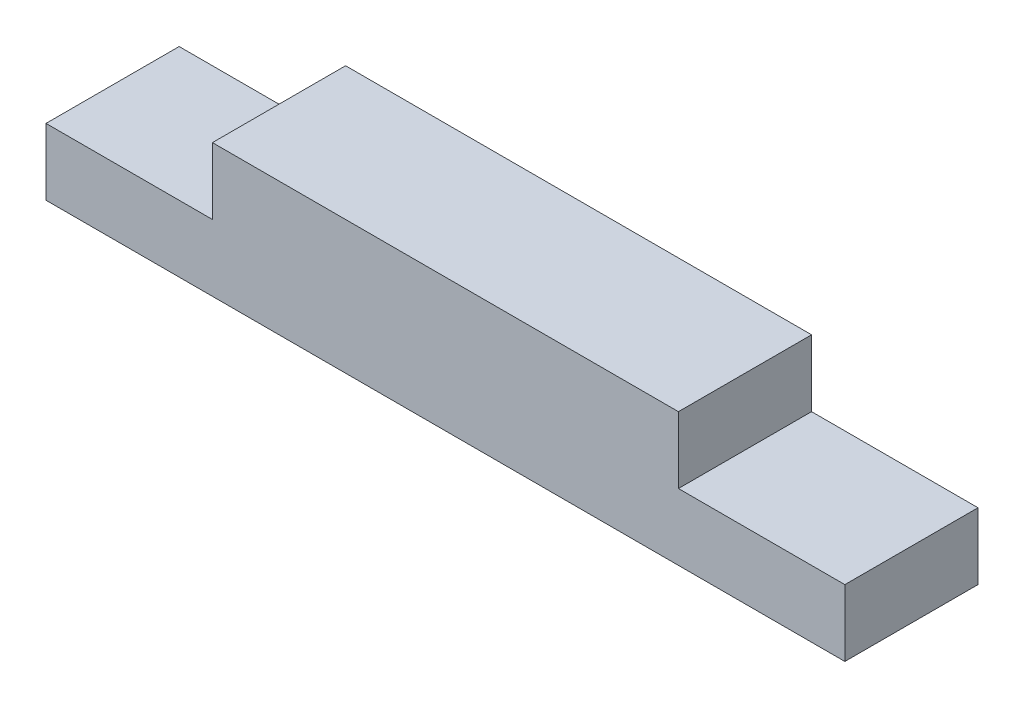
from build123d import *

# Parameters (mm, degrees)
SKETCH1_W           = 120
SKETCH1_H           = 20
BOSS_EXTRUDE1_DEPTH = 20
SKETCH2_W           = 25
SKETCH2_H           = 10
CUT_EXTRUDE1_DEPTH  = 20
SKETCH5_R           = 4.25
CUT_EXTRUDE3_DEPTH  = 10
SKETCH6_R           = 2.25
CUT_EXTRUDE4_DEPTH  = 10


with BuildPart() as part:
    # Sketch1 → Boss-Extrude1 (new body)
    with BuildSketch(Plane(origin=(0, 0, 0), x_dir=(1, 0, 0), z_dir=(0, 1, 0))):
        with Locations((60, 10)):
            Rectangle(SKETCH1_W, SKETCH1_H)
    extrude(amount=BOSS_EXTRUDE1_DEPTH)

    # Sketch2 → Cut-Extrude1 (cut)
    with BuildSketch(Plane.XY):
        with Locations((12.5, 15)):
            Rectangle(SKETCH2_W, SKETCH2_H)
        with Locations((107.5, 15)):
            Rectangle(SKETCH2_W, SKETCH2_H)
    extrude(amount=-CUT_EXTRUDE1_DEPTH, mode=Mode.SUBTRACT)

    # Sketch5 → Cut-Extrude3 (cut)
    with BuildSketch(Plane(origin=(0, 0, -20), x_dir=(-1, 0, 0), z_dir=(0, 0, -1))):
        with Locations((-60, 10)):
            Circle(SKETCH5_R)
    extrude(amount=-CUT_EXTRUDE3_DEPTH, mode=Mode.SUBTRACT)

    # Sketch6 → Cut-Extrude4 (cut)
    with BuildSketch(Plane(origin=(0, 0, 0), x_dir=(-1, 0, 0), z_dir=(0, -1, 0))):
        with Locations(Location((-80, 10, 0), (0, 0, 90))):
            Circle(SKETCH6_R)
        with Locations(Location((-40, 10, 0), (0, 0, 90))):
            Circle(SKETCH6_R)
    extrude(amount=-CUT_EXTRUDE4_DEPTH, mode=Mode.SUBTRACT)


solid = part.part
